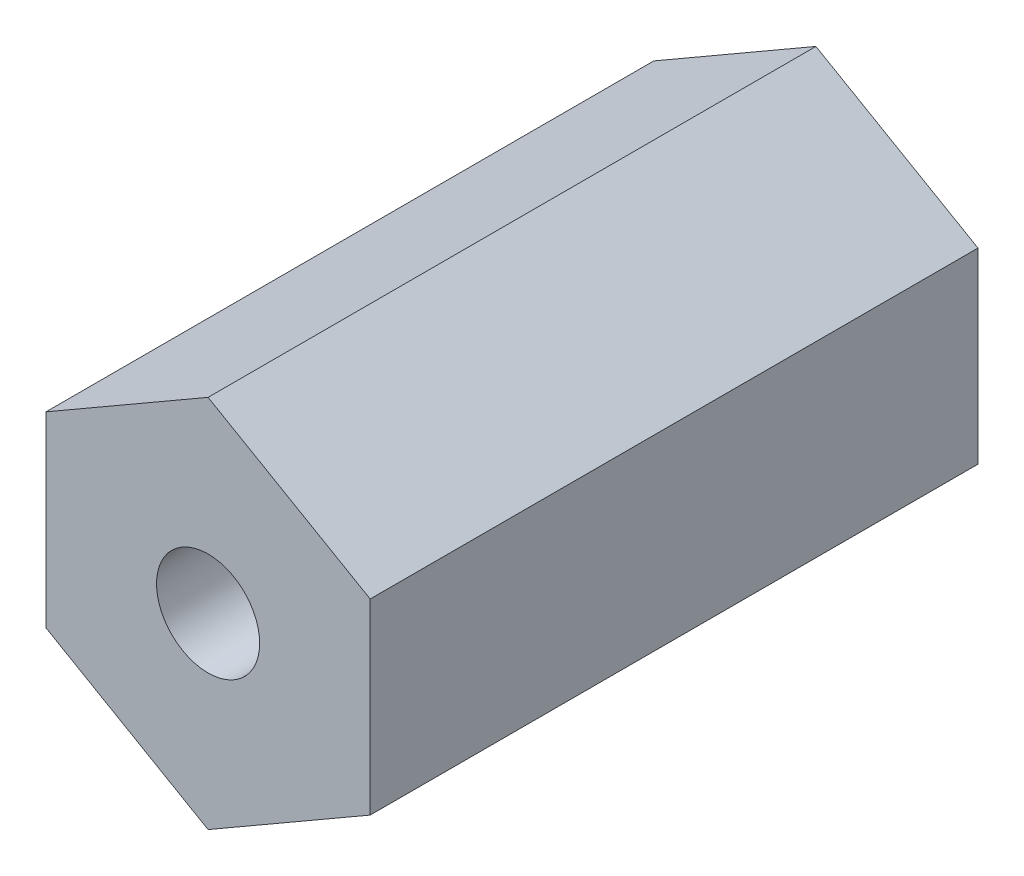
from build123d import *

# Parameters (mm, degrees)
SKETCH1_R           = 2.0193
BOSS_EXTRUDE1_DEPTH = 23.8125


with BuildPart() as part:
    # Sketch1 → Boss-Extrude1 (new body)
    with BuildSketch(Plane.XY):
        Polygon((0, 7.332348419), (-6.35, 3.666174209), (-6.35, -3.666174209), (0, -7.332348419), (6.35, -3.666174209), (6.35, 3.666174209), align=None)
        Circle(SKETCH1_R, mode=Mode.SUBTRACT)
    extrude(amount=BOSS_EXTRUDE1_DEPTH)


solid = part.part
